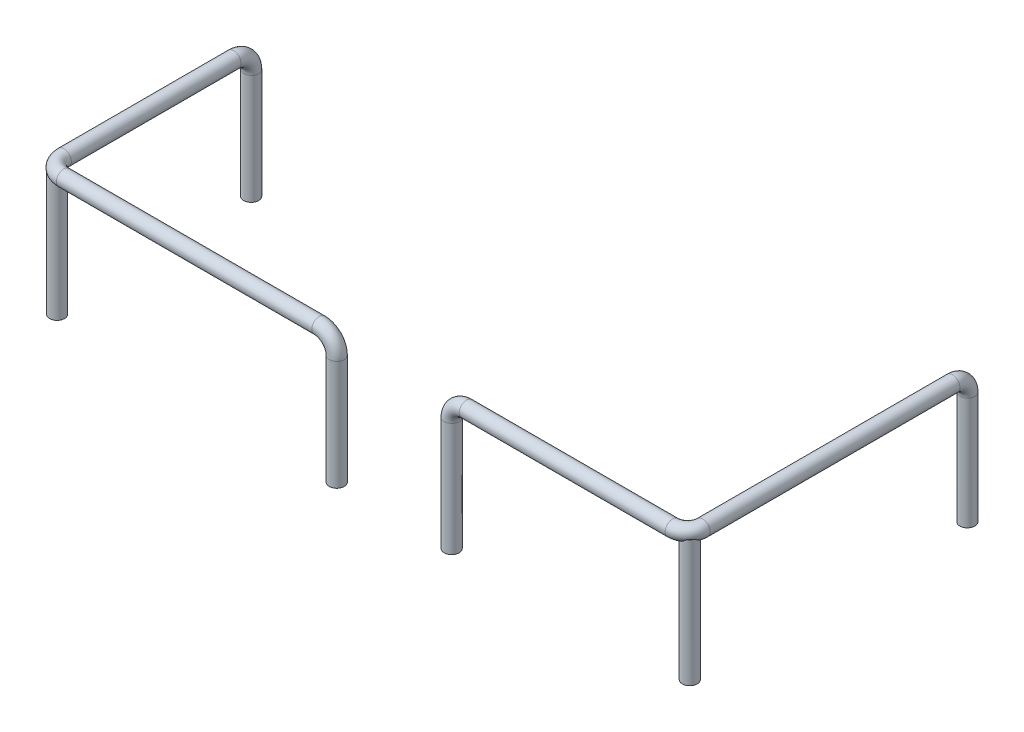
from build123d import *
from build123d.topology import SkipClean

# Parameters (mm, degrees)
CROQUIS1_R              = 60
SALIENTE_EXTRUIR1_DEPTH = 10
CROQUIS2_R              = 60
CROQUIS4_R              = 60
SALIENTE_EXTRUIR3_DEPTH = 1020
CROQUIS5_R              = 60
SALIENTE_EXTRUIR4_DEPTH = 10
CROQUIS6_R              = 60
CROQUIS7_R              = 60
SALIENTE_EXTRUIR5_DEPTH = 1011


with BuildPart() as part:
    # Croquis1 → Saliente-Extruir1 (new body)
    with BuildSketch(Plane(origin=(0, 0, 0), x_dir=(1, 0, 0), z_dir=(0, 1, 0))):
        with Locations(Location((0, 1640, 0), (0, 0, 270))):
            Circle(CROQUIS1_R)
    extrude(amount=SALIENTE_EXTRUIR1_DEPTH)

    # Barrer4: sweep along a curve in space
    with SkipClean():  # the faces are left unmerged after this step: merging them gives an invalid solid
        with BuildLine() as barrer4_path:
            Line((0, 0, -1640), (0, 880, -1640))
            ThreePointArc((0, 880, -1640), (0, 978.994949366, -1598.994949366), (0, 1020, -1500))
            Line((0, 1020, -1500), (0, 1020, -140))
            ThreePointArc((0, 1020, -140), (41.005050634, 1020, -41.005050634), (140, 1020, 0))
            Line((140, 1020, 0), (2185, 1020, 0))
            ThreePointArc((2185, 1020, 0), (2283.994949366, 978.994949366, 0), (2325, 880, 0))
            Line((2325, 0, 0), (2325, 880, 0))
        # Croquis2 → Barrer4 (sweep)
        with BuildSketch(Plane(origin=(0, 10, 0), x_dir=(1, 0, 0), z_dir=(0, 1, 0))):
            with Locations((0, 1640)):
                Circle(CROQUIS2_R)
        sweep(path=barrer4_path.line)

    # Croquis4 → Saliente-Extruir3 (add)
    with SkipClean():  # the faces are left unmerged after this step: merging them gives an invalid solid
        with BuildSketch(Plane(origin=(0, 0, 0), x_dir=(1, 0, 0), z_dir=(0, 1, 0))):
            with Locations(Location((41.194388487, 44.389834766, 0), (0, 0, 56.622542355))):
                Circle(CROQUIS4_R)
        extrude(amount=SALIENTE_EXTRUIR3_DEPTH)


with BuildPart() as body_2:
    # Croquis5 → Saliente-Extruir4 (new body)
    with BuildSketch(Plane(origin=(0, 0, 0), x_dir=(1, 0, 0), z_dir=(0, 1, 0))):
        with Locations(Location((3245, 0, 0), (0, 0, 270))):
            Circle(CROQUIS5_R)
    extrude(amount=SALIENTE_EXTRUIR4_DEPTH)

    # Barrer6: sweep along a curve in space
    with BuildLine() as barrer6_path:
        Line((3245, 10, 0), (3245, 910, 0))
        ThreePointArc((3245, 910, 0), (3280.147186258, 994.852813742, 0), (3365, 1030, 0))
        Line((5014.128708802, 1030, 0), (3365, 1030, 0))
        ThreePointArc((5134.128708802, 1030, -120), (5098.981522545, 1030, -35.147186258), (5014.128708802, 1030, 0))
        Line((5134.128708802, 1030, -120), (5134.128708802, 1030, -2120))
        ThreePointArc((5134.128708802, 1030, -2120), (5134.128708802, 994.852813742, -2204.852813742), (5134.128708802, 910, -2240))
        Line((5134.128708802, 910, -2240), (5134.128708802, 10, -2240))
    # Croquis6 → Barrer6 (sweep)
    with BuildSketch(Plane(origin=(0, 10, 0), x_dir=(1, 0, 0), z_dir=(0, 1, 0))):
        with Locations((3245, 0)):
            Circle(CROQUIS6_R)
    sweep(path=barrer6_path.line)

    # Croquis7 → Saliente-Extruir5 (add)
    with BuildSketch(Plane(origin=(0, 0, 0), x_dir=(1, 0, 0), z_dir=(0, 1, 0))):
        with Locations(Location((5107.102712577, 44.389834766, 0), (0, 0, 127.343296782))):
            Circle(CROQUIS7_R)
    extrude(amount=SALIENTE_EXTRUIR5_DEPTH)


solid = Compound([part.part, body_2.part])
